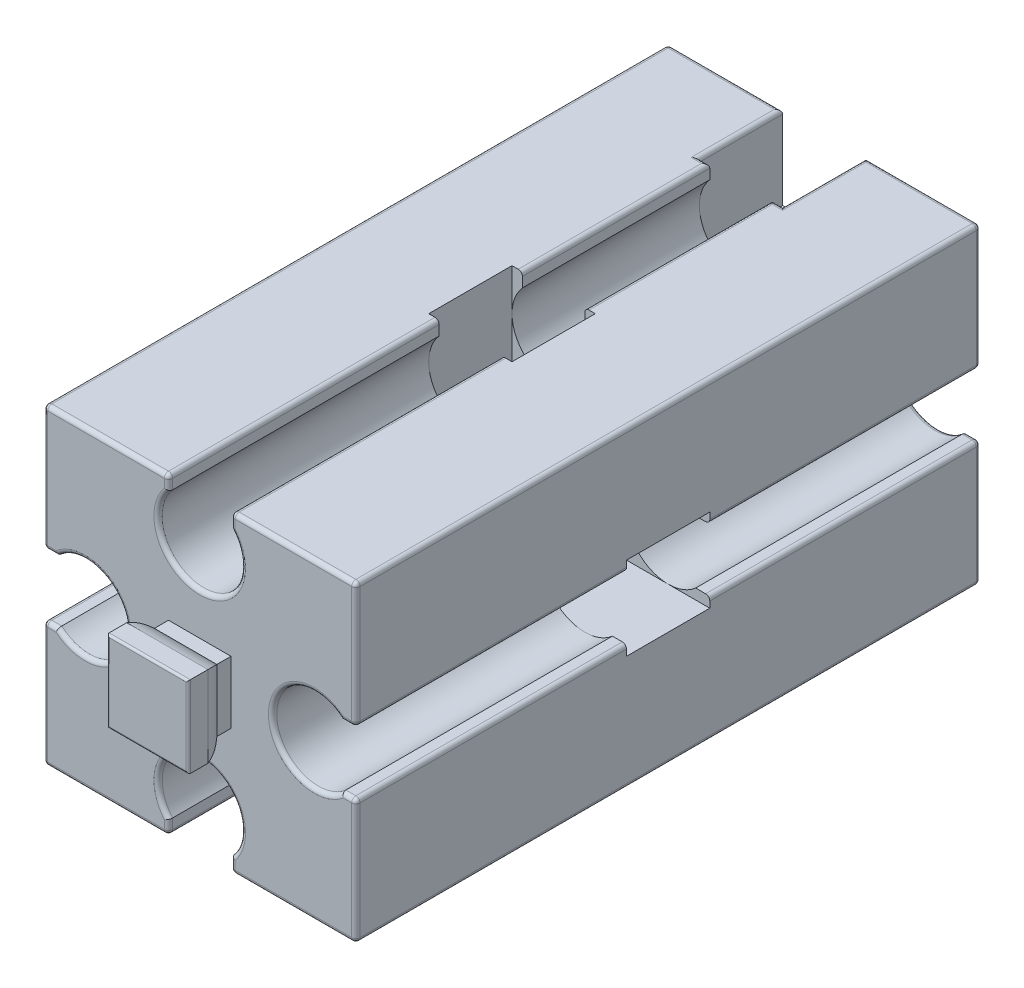
from build123d import *

# Parameters (mm, degrees)
SKETCH_1_W                      = 15
SKETCH_1_H                      = 15
EXTRUDE_1_DEPTH                 = 30
EXTRUDE_2_DEPTH                 = 1.5
EXTRUDE_2_DEPTH_BACK            = 1.5
SKETCH_2_W                      = 3
SKETCH_2_H                      = 1
EXTRUDE_3_DEPTH                 = 3
EXTRUDE_3_DEPTH_BACK            = 3
CUT_EXTRUDE_2_DEPTH             = 32.819805153
SKETCH_6_W                      = 4
SKETCH_6_H                      = 4
CUT_EXTRUDE_3_DEPTH             = 4
SKETCH_9_W                      = 4
SKETCH_9_H                      = 4
CUT_EXTRUDE_5_DEPTH             = 4
CUT_EXTRUDE_6_DEPTH             = 32.819805153
CUT_EXTRUDE_6_DEPTH_BACK        = 32.819805153
CUT_EXTRUDE_7_REACH             = 33.82
CUT_EXTRUDE_7_DIRECTION_2_REACH = 33.82
FILLET_2_R                      = 0.1
FILLET_3_R                      = 0.2
SKETCH_13_R                     = 2
CUT_EXTRUDE_8_DEPTH             = 35.369317799
SKETCH_14_W                     = 4
SKETCH_14_H                     = 4
CUT_EXTRUDE_9_DEPTH             = 4
SKETCH_15_W                     = 4
SKETCH_15_H                     = 4
CUT_EXTRUDE_10_DEPTH            = 4
SKETCH_16_R                     = 2
CUT_EXTRUDE_11_DEPTH            = 35.369317799
SKETCH_17_W                     = 4
SKETCH_17_H                     = 4
CUT_EXTRUDE_12_DEPTH            = 4
SKETCH_18_W                     = 4
SKETCH_18_H                     = 4
CUT_EXTRUDE_13_DEPTH            = 4


with BuildPart() as part:
    # 草图1 → 凸台-拉伸1 (new body)
    with BuildSketch(Plane.XY):
        Rectangle(SKETCH_1_W, SKETCH_1_H)
    extrude(amount=-EXTRUDE_1_DEPTH)

    # 草图2 → 凸台-拉伸2 (add, two sides: drawn at the far end of the back side and taken through both)
    with BuildSketch(Plane(origin=(0, 0, 0), x_dir=(1, 0, 0), z_dir=(0, 1, 0)).offset(-EXTRUDE_2_DEPTH_BACK)):
        with Locations((0, -0.5)):
            Rectangle(SKETCH_2_W, SKETCH_2_H)
    extrude(amount=EXTRUDE_2_DEPTH + EXTRUDE_2_DEPTH_BACK)

    # 草图3 → 凸台-拉伸3 (add, two sides: drawn at the far end of the back side and taken through both)
    with BuildSketch(Plane(origin=(0, 0, 0), x_dir=(1, 0, 0), z_dir=(0, 1, 0)).offset(-EXTRUDE_3_DEPTH_BACK)):
        with BuildLine():
            Line((-1.95, -2.5), (1.95, -2.5))
            Line((1.95, -2.5), (1.95, -1.555590279))
            ThreePointArc((1.95, -1.555590279), (1.780042303, -1.088161527), (1.5, -0.677124344))
            Line((1.5, -0.677124344), (-1.5, -0.677124344))
            ThreePointArc((-1.5, -0.677124344), (-1.780042303, -1.088161527), (-1.95, -1.555590279))
            Line((-1.95, -1.555590279), (-1.95, -2.5))
        make_face()
    extrude(amount=EXTRUDE_3_DEPTH + EXTRUDE_3_DEPTH_BACK)

    # 草图5 → 切除-拉伸2 (cut, through all)
    with BuildSketch(Plane.XY):
        with BuildLine():
            Line((-1.5, -7.5), (1.5, -7.5))
            Line((1.5, -7.5), (1.5, -6.822875656))
            ThreePointArc((1.5, -6.822875656), (0, -3.5), (-1.5, -6.822875656))
            Line((-1.5, -6.822875656), (-1.5, -7.5))
        make_face()
        with BuildLine():
            Line((1.5, 7.5), (1.5, 6.822875656))
            ThreePointArc((1.5, 6.822875656), (0, 3.5), (-1.5, 6.822875656))
            Line((-1.5, 6.822875656), (-1.5, 7.5))
            Line((-1.5, 7.5), (1.5, 7.5))
        make_face()
        with BuildLine():
            Line((-7.5, 1.5), (-6.822875656, 1.5))
            ThreePointArc((-6.822875656, 1.5), (-3.5, 0), (-6.822875656, -1.5))
            Line((-6.822875656, -1.5), (-7.5, -1.5))
            Line((-7.5, -1.5), (-7.5, 1.5))
        make_face()
        with BuildLine():
            Line((7.5, -1.5), (6.822875656, -1.5))
            ThreePointArc((6.822875656, -1.5), (3.5, 0), (6.822875656, 1.5))
            Line((6.822875656, 1.5), (7.5, 1.5))
            Line((7.5, 1.5), (7.5, -1.5))
        make_face()
    extrude(amount=-CUT_EXTRUDE_2_DEPTH, mode=Mode.SUBTRACT)

    # 草图6 → 切除-拉伸3 (cut)
    with BuildSketch(Plane(origin=(0, 7.5, 0), x_dir=(-1, 0, 0), z_dir=(0, 1, 0))):
        with Locations((0, -28)):
            Rectangle(SKETCH_6_W, SKETCH_6_H)
    extrude(amount=-CUT_EXTRUDE_3_DEPTH, mode=Mode.SUBTRACT)

    # 草图9 → 切除-拉伸5 (cut)
    with BuildSketch(Plane.XZ.offset(7.5)):
        with Locations((0, -28)):
            Rectangle(SKETCH_9_W, SKETCH_9_H)
    extrude(amount=-CUT_EXTRUDE_5_DEPTH, mode=Mode.SUBTRACT)

    # 草图11 → 切除-拉伸6 (cut, two sides: drawn at the far end of the back side and taken through both)
    with BuildSketch(Plane(origin=(0, 0, 0), x_dir=(1, 0, 0), z_dir=(0, 1, 0)).offset(-CUT_EXTRUDE_6_DEPTH_BACK)):
        with BuildLine():
            Line((-1.5, 30), (1.5, 30))
            Line((1.5, 30), (1.5, 29.322875656))
            ThreePointArc((1.5, 29.322875656), (0, 26), (-1.5, 29.322875656))
            Line((-1.5, 29.322875656), (-1.5, 30))
        make_face()
    extrude(amount=CUT_EXTRUDE_6_DEPTH + CUT_EXTRUDE_6_DEPTH_BACK, mode=Mode.SUBTRACT)

    # 草图12 → 切除-拉伸7 (cut, up to next)
    with BuildSketch(Plane(origin=(0, 0, 0), x_dir=(0, 0, -1), z_dir=(1, 0, 0)), mode=Mode.PRIVATE) as cut_extrude_7_sk1:
        with BuildLine():
            Line((-2.5, 3), (-2.5, 1.95))
            Line((-2.5, 1.95), (-1.555590279, 1.95))
            ThreePointArc((-1.555590279, 1.95), (-1.088161527, 1.780042303), (-0.677124344, 1.5))
            Line((-0.677124344, 1.5), (-0.677124344, 3))
            Line((-0.677124344, 3), (-2.5, 3))
        make_face()
    cut_extrude_7_tool1 = extrude(cut_extrude_7_sk1.sketch, amount=-CUT_EXTRUDE_7_REACH, mode=Mode.PRIVATE) & part.part
    # 草图12 → 切除-拉伸7 (cut, up to next)
    with BuildSketch(Plane(origin=(0, 0, 0), x_dir=(0, 0, -1), z_dir=(1, 0, 0)), mode=Mode.PRIVATE) as cut_extrude_7_sk2:
        with BuildLine():
            Line((-2.5, -1.95), (-1.555590279, -1.95))
            ThreePointArc((-1.555590279, -1.95), (-1.088161527, -1.780042303), (-0.677124344, -1.5))
            Line((-0.677124344, -1.5), (-0.677124344, -3))
            Line((-0.677124344, -3), (-2.5, -3))
            Line((-2.5, -3), (-2.5, -1.95))
        make_face()
    cut_extrude_7_tool2 = extrude(cut_extrude_7_sk2.sketch, amount=-CUT_EXTRUDE_7_REACH, mode=Mode.PRIVATE) & part.part
    add(cut_extrude_7_tool1.solids().sort_by_distance((0, 2.424924, 1.539049))[0], mode=Mode.SUBTRACT)
    add(cut_extrude_7_tool2.solids().sort_by_distance((0, -2.424924, 1.539049))[0], mode=Mode.SUBTRACT)

    # 草图12 → 切除-拉伸7 direction 2 (cut, up to next)
    with BuildSketch(Plane(origin=(0, 0, 0), x_dir=(0, 0, -1), z_dir=(1, 0, 0)), mode=Mode.PRIVATE) as cut_extrude_7_direction_2_sk1:
        with BuildLine():
            Line((-2.5, 3), (-2.5, 1.95))
            Line((-2.5, 1.95), (-1.555590279, 1.95))
            ThreePointArc((-1.555590279, 1.95), (-1.088161527, 1.780042303), (-0.677124344, 1.5))
            Line((-0.677124344, 1.5), (-0.677124344, 3))
            Line((-0.677124344, 3), (-2.5, 3))
        make_face()
    cut_extrude_7_direction_2_tool1 = extrude(cut_extrude_7_direction_2_sk1.sketch, amount=CUT_EXTRUDE_7_DIRECTION_2_REACH, mode=Mode.PRIVATE) & part.part
    # 草图12 → 切除-拉伸7 direction 2 (cut, up to next)
    with BuildSketch(Plane(origin=(0, 0, 0), x_dir=(0, 0, -1), z_dir=(1, 0, 0)), mode=Mode.PRIVATE) as cut_extrude_7_direction_2_sk2:
        with BuildLine():
            Line((-2.5, -1.95), (-1.555590279, -1.95))
            ThreePointArc((-1.555590279, -1.95), (-1.088161527, -1.780042303), (-0.677124344, -1.5))
            Line((-0.677124344, -1.5), (-0.677124344, -3))
            Line((-0.677124344, -3), (-2.5, -3))
            Line((-2.5, -3), (-2.5, -1.95))
        make_face()
    cut_extrude_7_direction_2_tool2 = extrude(cut_extrude_7_direction_2_sk2.sketch, amount=CUT_EXTRUDE_7_DIRECTION_2_REACH, mode=Mode.PRIVATE) & part.part
    add(cut_extrude_7_direction_2_tool1.solids().sort_by_distance((0, 2.424924, 1.539049))[0], mode=Mode.SUBTRACT)
    add(cut_extrude_7_direction_2_tool2.solids().sort_by_distance((0, -2.424924, 1.539049))[0], mode=Mode.SUBTRACT)

    # 圆角2
    fillet_2_edges = [part.edges().sort_by_distance(p)[0] for p in [
        (0, 1.95, 2.5),
        (-1.95, 0, 2.5),
        (1.95, 0, 2.5),
        (0, -1.95, 2.5),
    ]]
    fillet(fillet_2_edges, radius=FILLET_2_R)

    # 圆角3
    fillet_3_edges = [part.edges().sort_by_distance(p)[0] for p in [
        (7.5, -4.5, -30),
        (1.5, 7.5, -13),
        (-1.5, 7.5, -13),
        (-4.75, 7.5, -30),
        (-1.75, 7.5, -26),
        (-2, 7.5, -28),
        (1.75, 7.5, -26),
        (2, 7.5, -28),
        (4.75, 7.5, -30),
        (-1.5, -7.5, -13),
        (1.5, -7.5, -13),
        (4.75, -7.5, -30),
        (2, -7.5, -28),
        (1.75, -7.5, -26),
        (-1.75, -7.5, -26),
        (-2, -7.5, -28),
        (-7.5, 4.5, -30),
        (4.5, 7.5, 0),
        (7.5, -4.5, 0),
        (4.5, -7.5, 0),
        (-4.5, -7.5, 0),
        (0, -3.5, 0),
        (-1.5, -7.161437828, 0),
        (1.5, -7.161437828, 0),
        (-7.5, 4.5, 0),
        (-7.5, -4.5, -30),
        (-7.5, -4.5, 0),
        (-3.5, 0, -30),
        (-7.161437828, -1.5, -30),
        (-7.5, -1.5, -15),
        (-7.161437828, 1.5, -30),
        (-7.5, 1.5, -15),
        (-3.5, 0, 0),
        (-7.161437828, 1.5, 0),
        (-7.161437828, -1.5, 0),
        (-4.75, -7.5, -30),
        (-7.5, 7.5, -15),
        (7.5, 7.5, -15),
        (7.5, -7.5, -15),
        (-4.5, 7.5, 0),
        (-7.5, -7.5, -15),
        (0, 3.5, 0),
        (1.5, 7.161437828, 0),
        (-1.5, 7.161437828, 0),
        (7.5, 4.5, -30),
        (7.5, 4.5, 0),
        (3.5, 0, -30),
        (7.161437828, 1.5, -30),
        (7.5, 1.5, -15),
        (7.161437828, -1.5, -30),
        (7.5, -1.5, -15),
        (3.5, 0, 0),
        (7.161437828, -1.5, 0),
        (7.161437828, 1.5, 0),
    ]]
    fillet(fillet_3_edges, radius=FILLET_3_R)

    # 草图13 → 切除-拉伸8 (cut, through all)
    with BuildSketch(Plane(origin=(7.5, 0, 0), x_dir=(0, 0, -1), z_dir=(1, 0, 0))):
        with Locations(Location((15, 0, 0), (0, 0, 90))):
            Circle(SKETCH_13_R)
    extrude(amount=-CUT_EXTRUDE_8_DEPTH, mode=Mode.SUBTRACT)

    # 草图14 → 切除-拉伸9 (cut)
    with BuildSketch(Plane(origin=(7.5, 0, 0), x_dir=(0, 0, -1), z_dir=(1, 0, 0))):
        with Locations((15, 0)):
            Rectangle(SKETCH_14_W, SKETCH_14_H)
    extrude(amount=-CUT_EXTRUDE_9_DEPTH, mode=Mode.SUBTRACT)

    # 草图15 → 切除-拉伸10 (cut)
    with BuildSketch(Plane.ZY.offset(7.5)):
        with Locations((-15, 0)):
            Rectangle(SKETCH_15_W, SKETCH_15_H)
    extrude(amount=-CUT_EXTRUDE_10_DEPTH, mode=Mode.SUBTRACT)

    # 草图16 → 切除-拉伸11 (cut, through all)
    with BuildSketch(Plane(origin=(0, 7.5, 0), x_dir=(-1, 0, 0), z_dir=(0, 1, 0))):
        with Locations(Location((0, -15, 0), (0, 0, 90))):
            Circle(SKETCH_16_R)
    extrude(amount=-CUT_EXTRUDE_11_DEPTH, mode=Mode.SUBTRACT)

    # 草图17 → 切除-拉伸12 (cut)
    with BuildSketch(Plane(origin=(0, 7.5, 0), x_dir=(-1, 0, 0), z_dir=(0, 1, 0))):
        with Locations((0, -15)):
            Rectangle(SKETCH_17_W, SKETCH_17_H)
    extrude(amount=-CUT_EXTRUDE_12_DEPTH, mode=Mode.SUBTRACT)

    # 草图18 → 切除-拉伸13 (cut)
    with BuildSketch(Plane.XZ.offset(7.5)):
        with Locations((0, -15)):
            Rectangle(SKETCH_18_W, SKETCH_18_H)
    extrude(amount=-CUT_EXTRUDE_13_DEPTH, mode=Mode.SUBTRACT)


solid = part.part
